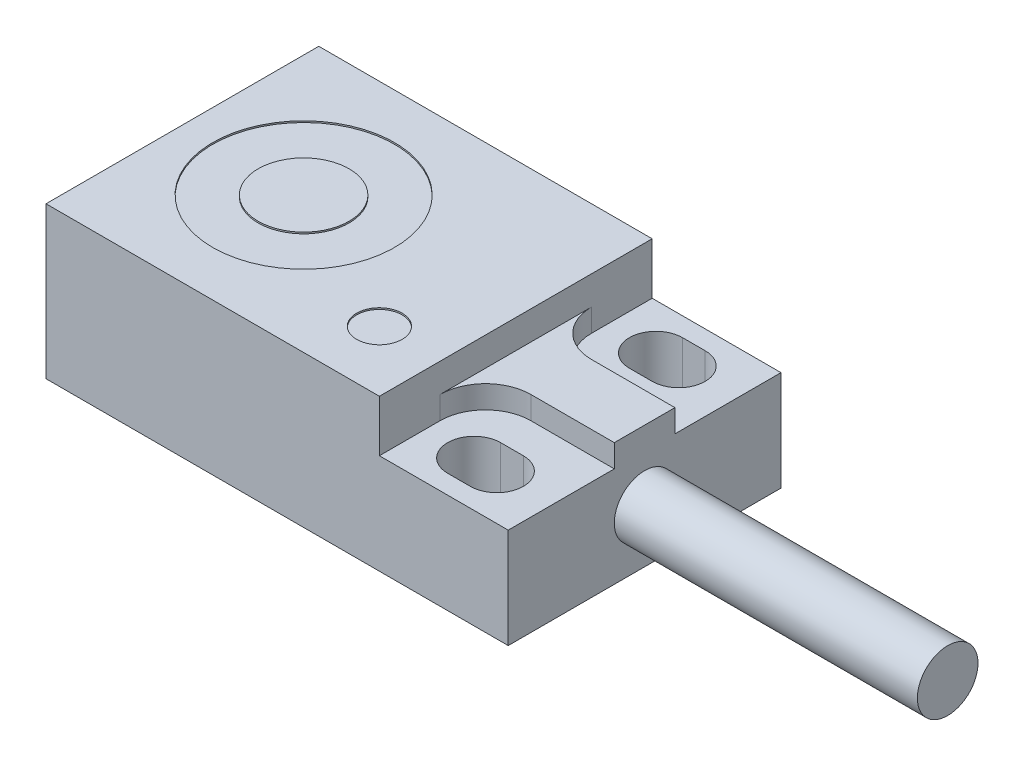
from build123d import *

# Parameters (mm, degrees)
ESQUISSE2_W             = 30.5
ESQUISSE2_H             = 18
BOSS_EXTRU_1_DEPTH      = 10
ESQUISSE3_W             = 8.5
ESQUISSE3_H             = 7
ENL_V_MAT_EXTRU_1_DEPTH = 3.4
ENL_V_MAT_EXTRU_2_DEPTH = 19.897685043
ESQUISSE7_W             = 8.5
ESQUISSE7_H             = 4
ENL_V_MAT_EXTRU_4_DEPTH = 1.9
CONG_1_R                = 3
ESQUISSE5_R             = 6
ESQUISSE5_R_2           = 3
ESQUISSE5_R_3           = 1.5
ENL_V_MAT_EXTRU_3_DEPTH = 0.1
ESQUISSE6_R             = 2
BOSS_EXTRU_2_DEPTH      = 20


with BuildPart() as part:
    # Esquisse2 → Boss.-Extru.1 (new body)
    with BuildSketch(Plane(origin=(0, 0, 0), x_dir=(1, 0, 0), z_dir=(0, 1, 0))):
        Rectangle(ESQUISSE2_W, ESQUISSE2_H)
    extrude(amount=BOSS_EXTRU_1_DEPTH)

    # Esquisse3 → Enlèv. mat.-Extru.1 (cut)
    with BuildSketch(Plane(origin=(0, 10, 0), x_dir=(1, 0, 0), z_dir=(0, 1, 0))):
        with Locations((11, -5.5)):
            Rectangle(ESQUISSE3_W, ESQUISSE3_H)
        with Locations((11, 5.5)):
            Rectangle(ESQUISSE3_W, ESQUISSE3_H)
    extrude(amount=-ENL_V_MAT_EXTRU_1_DEPTH, mode=Mode.SUBTRACT)

    # Esquisse4 → Enlèv. mat.-Extru.2 (cut, through all)
    with BuildSketch(Plane(origin=(0, 6.6, 0), x_dir=(1, 0, 0), z_dir=(0, 1, 0))):
        with BuildLine():
            Line((10, 7.75), (11.5, 7.75))
            ThreePointArc((11.5, 7.75), (13.25, 6), (11.5, 4.25))
            Line((11.5, 4.25), (10, 4.25))
            ThreePointArc((10, 4.25), (8.25, 6), (10, 7.75))
        make_face()
        with BuildLine():
            Line((10, -7.75), (11.5, -7.75))
            ThreePointArc((11.5, -7.75), (13.25, -6), (11.5, -4.25))
            Line((11.5, -4.25), (10, -4.25))
            ThreePointArc((10, -4.25), (8.25, -6), (10, -7.75))
        make_face()
    extrude(amount=-ENL_V_MAT_EXTRU_2_DEPTH, mode=Mode.SUBTRACT)

    # Esquisse7 → Enlèv. mat.-Extru.4 (cut)
    with BuildSketch(Plane(origin=(0, 10, 0), x_dir=(1, 0, 0), z_dir=(0, 1, 0))):
        with Locations((11, 0)):
            Rectangle(ESQUISSE7_W, ESQUISSE7_H)
    extrude(amount=-ENL_V_MAT_EXTRU_4_DEPTH, mode=Mode.SUBTRACT)

    # Congé1
    cong_1_edges = [part.edges().sort_by_distance(p)[0] for p in [
        (6.75, 7.35, 2),
        (6.75, 7.35, -2),
    ]]
    fillet(cong_1_edges, radius=CONG_1_R)

    # Esquisse5 → Enlèv. mat.-Extru.3 (cut)
    # profile 1 of 2: a face of its own
    with BuildSketch(Plane(origin=(0, 10, 0), x_dir=(1, 0, 0), z_dir=(0, 1, 0))):
        with Locations(Location((-7.25, 0, 0), (0, 0, 270))):
            Circle(ESQUISSE5_R)
        with Locations(Location((-7.25, 0, 0), (0, 0, 270))):
            Circle(ESQUISSE5_R_2, mode=Mode.SUBTRACT)
    # profile 2 of 2: a face of its own
    with BuildSketch(Plane(origin=(0, 10, 0), x_dir=(1, 0, 0), z_dir=(0, 1, 0))):
        with Locations(Location((2.75, -5, 0), (0, 0, 270))):
            Circle(ESQUISSE5_R_3)
    extrude(amount=-ENL_V_MAT_EXTRU_3_DEPTH, mode=Mode.SUBTRACT)

    # Esquisse6 → Boss.-Extru.2 (add)
    with BuildSketch(Plane(origin=(15.25, 0, 0), x_dir=(0, 0, -1), z_dir=(1, 0, 0))):
        with Locations(Location((0, 3.5, 0), (0, 0, 180))):
            Circle(ESQUISSE6_R)
    extrude(amount=BOSS_EXTRU_2_DEPTH)


solid = part.part
